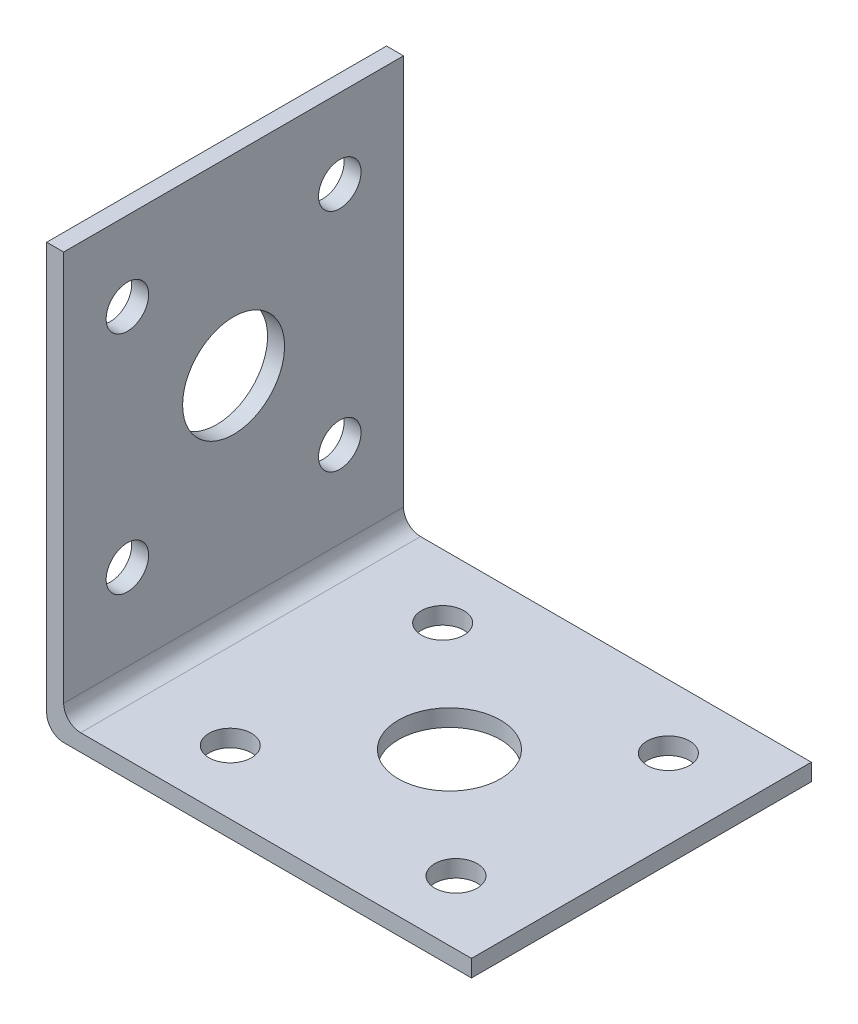
from build123d import *

# Parameters (mm, degrees)
BOSS_EXTRUDE1_DEPTH = 20
SKETCH3_R           = 6
SKETCH3_R_2         = 2.5
CUT_EXTRUDE1_DEPTH  = 40


with BuildPart() as part:
    # Sketch1 → Boss-Extrude1 (new, symmetric)
    with BuildSketch(Plane.XY):
        with BuildLine():
            Line((0, 2), (0, 50))
            Line((0, 50), (2, 50))
            Line((2, 50), (2, 4))
            ThreePointArc((2, 4), (2.585786438, 2.585786438), (4, 2))
            Line((4, 2), (50, 2))
            Line((50, 2), (50, 0))
            Line((50, 0), (2, 0))
            ThreePointArc((2, 0), (0.585786438, 0.585786438), (0, 2))
        make_face()
    extrude(amount=BOSS_EXTRUDE1_DEPTH, both=True)

    # Sketch3 → Cut-Extrude1 (cut)
    with BuildSketch(Plane(origin=(0, 2, 0), x_dir=(1, 0, 0), z_dir=(0, 1, 0))):
        with Locations(Location((27.405417893, 0, 0), (0, 0, 270))):
            Circle(SKETCH3_R)
        with Locations(Location((40.675078118, 12.5, 0), (0, 0, 270))):
            Circle(SKETCH3_R_2)
        with Locations(Location((40.675078118, -12.5, 0), (0, 0, 270))):
            Circle(SKETCH3_R_2)
        with Locations(Location((14.107643981, -12.5, 0), (0, 0, 270))):
            Circle(SKETCH3_R_2)
        with Locations(Location((14.107643981, 12.5, 0), (0, 0, 270))):
            Circle(SKETCH3_R_2)
    cut_extrude1 = extrude(amount=-CUT_EXTRUDE1_DEPTH, mode=Mode.SUBTRACT)

    # Mirror1: Cut-Extrude1 across plane
    add(cut_extrude1.mirror(Plane(origin=(0, 0, 0), x_dir=(0, 0, 1), z_dir=(-0.7071067811865488, 0.7071067811865464, 0))), mode=Mode.SUBTRACT)


solid = part.part
